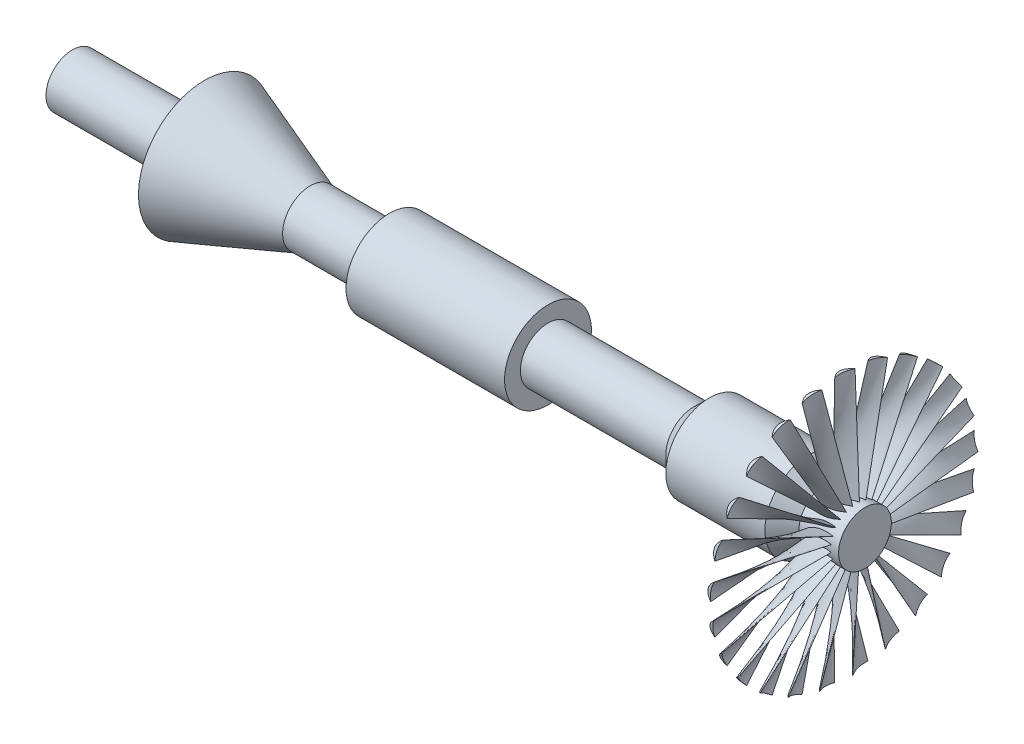
from build123d import *

# Parameters (mm, degrees)
CIRPATTERN1_COUNT = 25


with BuildPart() as part:
    # Sketch1 → Revolve1 (revolve)
    with BuildSketch(Plane.XY, mode=Mode.PRIVATE) as revolve1_sk:
        Polygon((-300, 0), (300, 0), (300, 20), (270, 20), (257.117618741, 32.882381259), (182.117618741, 32.882381259), (170.117618741, 20.882381259), (60, 20.882381259), (60, 32.882381259), (-60, 32.882381259), (-60, 20.882381259), (-120, 20.882381259), (-200, 50), (-200, 20), (-300, 20), align=None)
    revolve(revolve1_sk.sketch.rotate(Axis((-300, 0, 0), (1, 0, 0)), 90), axis=Axis((-300, 0, 0), (1, 0, 0)))

    # Sketch3 → Loft1 section 0
    with BuildSketch(Plane(origin=(0, 100, 0), x_dir=(1, 0, 0), z_dir=(0, 1, 0))):
        with BuildLine():
            add(Edge.make_bspline(
                [(285.297125269, 7.168274043), (281.878740985, 0.750758434), (283.399013597, -6.282137978)],
                knots=[0, 0, 0, 1, 1, 1], degree=2))
            add(Edge.make_bspline(
                [(285.297125269, 7.168274043), (277.535997225, 1.026465036), (283.399013597, -6.282137978)],
                knots=[0, 0, 0, 1, 1, 1], degree=2))
        make_face()
    # Sketch2 → Loft1 section 1
    with BuildSketch(Plane(origin=(0, 0, 0), x_dir=(1, 0, 0), z_dir=(0, 1, 0))):
        with BuildLine():
            add(Edge.make_bspline(
                [(275.278604459, 0), (285.908960719, 3.4343279), (296.597797633, 0)],
                knots=[0, 0, 0, 1, 1, 1], degree=2))
            add(Edge.make_bspline(
                [(275.278604459, 0), (285.908960719, -3.4343279), (296.597797633, 0)],
                knots=[0, 0, 0, 1, 1, 1], degree=2))
        make_face()
    loft1 = loft()

    # CirPattern1: Loft1 ×25 about axis
    cirpattern1_axis = Axis((300, 0, 0), (-1, 0, 0))
    for i in range(1, CIRPATTERN1_COUNT):
        add(loft1.rotate(cirpattern1_axis, i * 360 / CIRPATTERN1_COUNT))


solid = part.part
